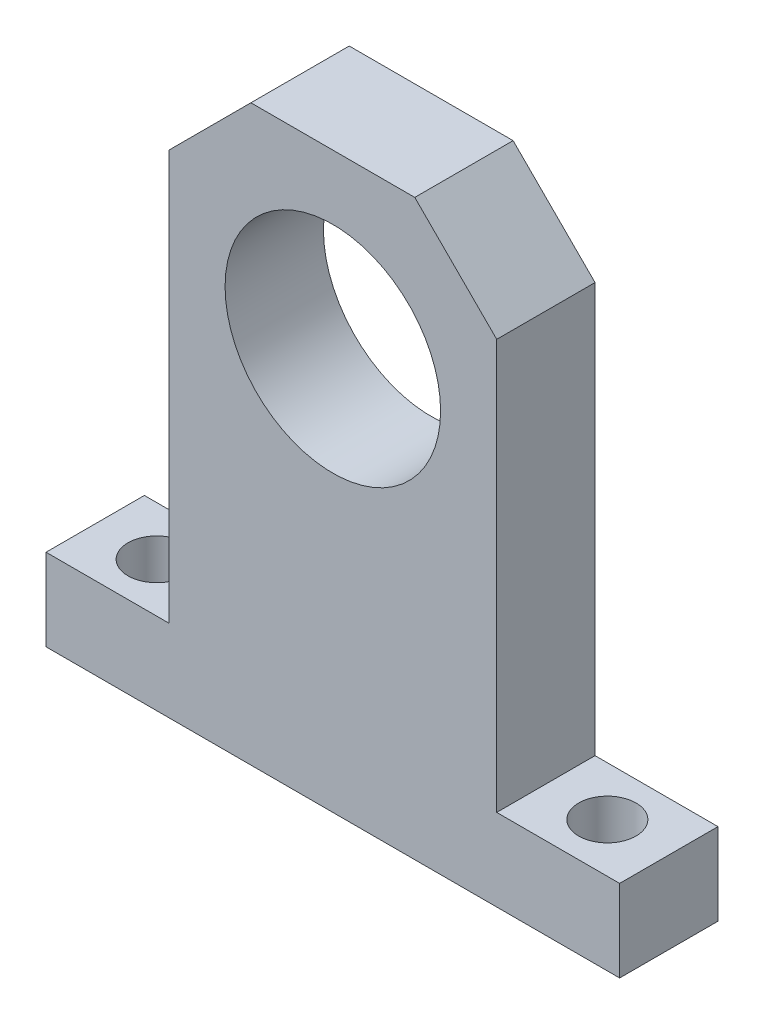
from build123d import *

# Parameters (mm, degrees)
SKETCH_1_R          = 13.15
EXTRUDE_1_DEPTH     = 12
SKETCH_2_R          = 3.5
CUT_EXTRUDE_2_DEPTH = 83.273932688
SKETCH_3_R          = 3.5
CUT_EXTRUDE_3_DEPTH = 83.273932688
CHAMFER_1_SIZE      = 10
CHAMFER_2_SIZE      = 10


with BuildPart() as part:
    # 草圖1 → 填料-伸長1 (new body)
    with BuildSketch(Plane.XY):
        Polygon((40, 0), (55, 0), (55, -10), (-15, -10), (-15, 0), (0, 0), (0, 60), (40, 60), align=None)
        with Locations((20, 39)):
            Circle(SKETCH_1_R, mode=Mode.SUBTRACT)
    extrude(amount=EXTRUDE_1_DEPTH)

    # 草圖2 → 除料-伸長2 (cut, through all)
    with BuildSketch(Plane(origin=(0, 0, 0), x_dir=(1, 0, 0), z_dir=(0, 1, 0))):
        with Locations(Location((47.5, -6, 0), (0, 0, 270))):
            Circle(SKETCH_2_R)
    extrude(amount=-CUT_EXTRUDE_2_DEPTH, mode=Mode.SUBTRACT)

    # 草圖3 → 除料-伸長3 (cut, through all)
    with BuildSketch(Plane(origin=(0, 0, 0), x_dir=(1, 0, 0), z_dir=(0, 1, 0))):
        with Locations(Location((-7.5, -6, 0), (0, 0, 270))):
            Circle(SKETCH_3_R)
    extrude(amount=-CUT_EXTRUDE_3_DEPTH, mode=Mode.SUBTRACT)

    # 導角1
    chamfer_1_edges = [part.edges().sort_by_distance(p)[0] for p in [
        (0, 60, 6),
    ]]
    chamfer(chamfer_1_edges, length=CHAMFER_1_SIZE)

    # 導角2
    chamfer_2_edges = [part.edges().sort_by_distance(p)[0] for p in [
        (40, 60, 6),
    ]]
    chamfer(chamfer_2_edges, length=CHAMFER_2_SIZE)


solid = part.part
